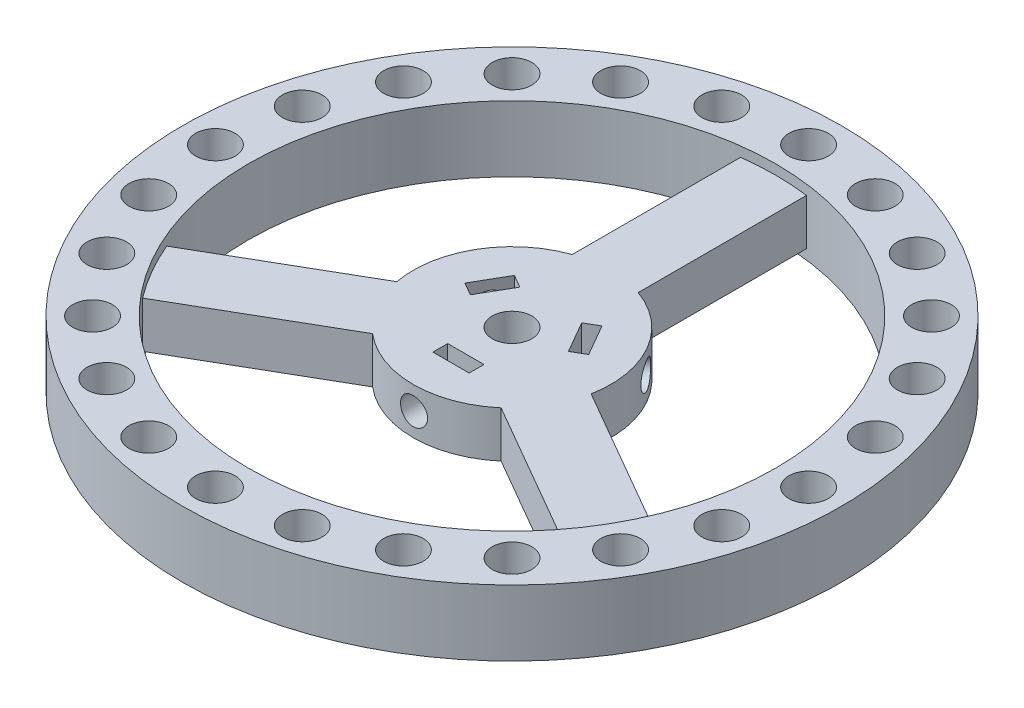
from build123d import *

# Parameters (mm, degrees)
SKETCH2_R                = 3
BOSS_EXTRUDE4_DEPTH      = 10
BOSS_EXTRUDE8_DEPTH      = 3.5
BOSS_EXTRUDE8_DEPTH_BACK = 3.5
BOSS_EXTRUDE8_START      = 5
SKETCH7_W                = 5.5
SKETCH7_H                = 2.25
CUT_EXTRUDE2_DEPTH       = 72.219730412
CUT_EXTRUDE3_DEPTH       = 16
CUT_EXTRUDE4_DEPTH       = 17
CUT_EXTRUDE5_DEPTH       = 22


with BuildPart() as part:
    # Sketch2 → Boss-Extrude4 (new body)
    # profile 1 of 4: a face of its own
    with BuildSketch(Plane(origin=(0, 0, 0), x_dir=(1, 0, 0), z_dir=(0, 1, 0))):
        with BuildLine():
            Line((0, -42), (0, -40))
            ThreePointArc((0, -40), (-17.79142386, -35.825483068), (-31.869317712, -24.173261852))
            ThreePointArc((-31.869317712, -24.173261852), (-33.320566566, -22.13006651), (-34.641016151, -20))
            Line((-34.641016151, -20), (-36.373066959, -21))
            ThreePointArc((-36.373066959, -21), (-36.073365691, -21.723542865), (-35.97114317, -22.5))
            ThreePointArc((-35.97114317, -22.5), (-38.194686035, -25.397777479), (-41.569219382, -24))
            Line((-41.569219382, -24), (-43.301270189, -25))
            ThreePointArc((-43.301270189, -25), (-25, -43.301270189), (0, -50))
            Line((0, -50), (0, -48))
            ThreePointArc((0, -48), (-3, -45), (0, -42))
        make_face()
        with Locations(Location((-31.819805153, -31.819805153, 0), (0, 0, 270))):
            Circle(SKETCH2_R, mode=Mode.SUBTRACT)
        with Locations(Location((-22.5, -38.97114317, 0), (0, 0, 270))):
            Circle(SKETCH2_R, mode=Mode.SUBTRACT)
        with Locations(Location((-11.64685703, -43.466662183, 0), (0, 0, 270))):
            Circle(SKETCH2_R, mode=Mode.SUBTRACT)
    # profile 2 of 4: a face of its own
    with BuildSketch(Plane(origin=(0, 0, 0), x_dir=(1, 0, 0), z_dir=(0, 1, 0))):
        with BuildLine():
            Line((-36.373066959, -21), (-34.641016151, -20))
            ThreePointArc((-34.641016151, -20), (-35.825483068, -17.79142386), (-36.869317712, -15.513007814))
            ThreePointArc((-36.869317712, -15.513007814), (-34.641016151, 20), (-5, 39.686269666))
            ThreePointArc((-5, 39.686269666), (-2.504916502, 39.921490369), (0, 40))
            Line((0, 40), (0, 42))
            ThreePointArc((0, 42), (-3, 45), (0, 48))
            Line((0, 48), (0, 50))
            ThreePointArc((0, 50), (-43.301270189, 25), (-43.301270189, -25))
            Line((-43.301270189, -25), (-41.569219382, -24))
            ThreePointArc((-41.569219382, -24), (-40.47114317, -19.901923789), (-36.373066959, -21))
        make_face()
        with Locations(Location((-43.466662183, -11.64685703, 0), (0, 0, 270))):
            Circle(SKETCH2_R, mode=Mode.SUBTRACT)
        with Locations(Location((-45, 0, 0), (0, 0, 270))):
            Circle(SKETCH2_R, mode=Mode.SUBTRACT)
        with Locations(Location((-43.466662183, 11.64685703, 0), (0, 0, 270))):
            Circle(SKETCH2_R, mode=Mode.SUBTRACT)
        with Locations(Location((-38.97114317, 22.5, 0), (0, 0, 270))):
            Circle(SKETCH2_R, mode=Mode.SUBTRACT)
        with Locations(Location((-31.819805153, 31.819805153, 0), (0, 0, 270))):
            Circle(SKETCH2_R, mode=Mode.SUBTRACT)
        with Locations(Location((-22.5, 38.97114317, 0), (0, 0, 270))):
            Circle(SKETCH2_R, mode=Mode.SUBTRACT)
        with BuildLine():
            ThreePointArc((-8.64685703, 43.466662183), (-8.650208153, 43.324903542), (-8.660254038, 43.183461601))
            ThreePointArc((-8.660254038, 43.183461601), (-14.64685703, 43.466662183), (-8.660254038, 43.749862765))
            ThreePointArc((-8.660254038, 43.749862765), (-8.650208153, 43.608420824), (-8.64685703, 43.466662183))
        make_face(mode=Mode.SUBTRACT)
    # profile 3 of 4: a face of its own
    with BuildSketch(Plane(origin=(0, 0, 0), x_dir=(1, 0, 0), z_dir=(0, 1, 0))):
        with BuildLine():
            ThreePointArc((36.869317712, -15.513007814), (35.825483068, -17.79142386), (34.641016151, -20))
            Line((34.641016151, -20), (36.373066959, -21))
            ThreePointArc((36.373066959, -21), (39.747600306, -19.602222521), (41.97114317, -22.5))
            ThreePointArc((41.97114317, -22.5), (41.868920649, -23.276457135), (41.569219382, -24))
            Line((41.569219382, -24), (43.301270189, -25))
            ThreePointArc((43.301270189, -25), (48.296291314, -12.940952255), (50, 0))
            ThreePointArc((50, 0), (35.355339059, 35.355339059), (0, 50))
            Line((0, 50), (0, 48))
            ThreePointArc((0, 48), (2.121320344, 47.121320344), (3, 45))
            ThreePointArc((3, 45), (2.121320344, 42.878679656), (0, 42))
            Line((0, 42), (0, 40))
            ThreePointArc((0, 40), (2.504916502, 39.921490369), (5, 39.686269666))
            ThreePointArc((5, 39.686269666), (30, 26.457513111), (40, 0))
            ThreePointArc((40, 0), (39.209518669, -7.912878475), (36.869317712, -15.513007814))
        make_face()
        with Locations(Location((43.466662183, -11.64685703, 0), (0, 0, 270))):
            Circle(SKETCH2_R, mode=Mode.SUBTRACT)
        with Locations(Location((45, 0, 0), (0, 0, 270))):
            Circle(SKETCH2_R, mode=Mode.SUBTRACT)
        with Locations(Location((43.466662183, 11.64685703, 0), (0, 0, 270))):
            Circle(SKETCH2_R, mode=Mode.SUBTRACT)
        with Locations(Location((38.97114317, 22.5, 0), (0, 0, 270))):
            Circle(SKETCH2_R, mode=Mode.SUBTRACT)
        with BuildLine():
            ThreePointArc((14.64685703, 43.466662183), (11.788615671, 40.470013307), (8.660254038, 43.183461601))
            ThreePointArc((8.660254038, 43.183461601), (8.64685703, 43.466662183), (8.660254038, 43.749862765))
            ThreePointArc((8.660254038, 43.749862765), (11.788615671, 46.463311059), (14.64685703, 43.466662183))
        make_face(mode=Mode.SUBTRACT)
        with Locations(Location((22.5, 38.97114317, 0), (0, 0, 270))):
            Circle(SKETCH2_R, mode=Mode.SUBTRACT)
        with Locations(Location((31.819805153, 31.819805153, 0), (0, 0, 270))):
            Circle(SKETCH2_R, mode=Mode.SUBTRACT)
    # profile 4 of 4: a face of its own
    with BuildSketch(Plane(origin=(0, 0, 0), x_dir=(1, 0, 0), z_dir=(0, 1, 0))):
        with BuildLine():
            ThreePointArc((31.869317712, -24.173261852), (17.79142386, -35.825483068), (0, -40))
            Line((0, -40), (0, -42))
            ThreePointArc((0, -42), (2.121320344, -42.878679656), (3, -45))
            ThreePointArc((3, -45), (2.121320344, -47.121320344), (0, -48))
            Line((0, -48), (0, -50))
            ThreePointArc((0, -50), (25, -43.301270189), (43.301270189, -25))
            Line((43.301270189, -25), (41.569219382, -24))
            ThreePointArc((41.569219382, -24), (37.47114317, -25.098076211), (36.373066959, -21))
            Line((36.373066959, -21), (34.641016151, -20))
            ThreePointArc((34.641016151, -20), (33.320566566, -22.13006651), (31.869317712, -24.173261852))
        make_face()
        with Locations(Location((11.64685703, -43.466662183, 0), (0, 0, 270))):
            Circle(SKETCH2_R, mode=Mode.SUBTRACT)
        with Locations(Location((22.5, -38.97114317, 0), (0, 0, 270))):
            Circle(SKETCH2_R, mode=Mode.SUBTRACT)
        with Locations(Location((31.819805153, -31.819805153, 0), (0, 0, 270))):
            Circle(SKETCH2_R, mode=Mode.SUBTRACT)
    extrude(amount=BOSS_EXTRUDE4_DEPTH)

    # Sketch6 → Boss-Extrude8 (add, two sides: drawn at the far end of the back side and taken through both)
    with BuildSketch(Plane(origin=(0, 0, 0), x_dir=(1, 0, 0), z_dir=(0, 1, 0)).offset(BOSS_EXTRUDE8_START - BOSS_EXTRUDE8_DEPTH_BACK)):
        with BuildLine():
            Line((-34.641016151, -20), (-12.990381057, -7.5))
            ThreePointArc((-12.990381057, -7.5), (-14.071565699, -5.195290056), (-14.747448714, -2.740940793))
            Line((-14.747448714, -2.740940793), (-36.869317712, -15.513007814))
            ThreePointArc((-36.869317712, -15.513007814), (-35.825483068, -17.79142386), (-34.641016151, -20))
        make_face()
        with BuildLine():
            ThreePointArc((-9.747448714, -11.401194831), (-11.535036018, -9.588688339), (-12.990381057, -7.5))
            Line((-12.990381057, -7.5), (-34.641016151, -20))
            ThreePointArc((-34.641016151, -20), (-33.320566566, -22.13006651), (-31.869317712, -24.173261852))
            Line((-31.869317712, -24.173261852), (-9.747448714, -11.401194831))
        make_face()
        with BuildLine():
            Line((-12.990381057, -7.5), (0, 0))
            Line((0, 0), (0, 15))
            ThreePointArc((0, 15), (-2.536529681, 14.783978395), (-5, 14.142135624))
            ThreePointArc((-5, 14.142135624), (-12.990381057, 7.5), (-14.747448714, -2.740940793))
            ThreePointArc((-14.747448714, -2.740940793), (-14.071565699, -5.195290056), (-12.990381057, -7.5))
        make_face()
        with BuildLine():
            Line((0, 15), (0, 0))
            Line((0, 0), (12.990381057, -7.5))
            ThreePointArc((12.990381057, -7.5), (14.071565699, -5.195290056), (14.747448714, -2.740940793))
            ThreePointArc((14.747448714, -2.740940793), (14.936728737, -1.376275643), (15, 0))
            ThreePointArc((15, 0), (12.247448714, 8.660254038), (5, 14.142135624))
            ThreePointArc((5, 14.142135624), (2.536529681, 14.783978395), (0, 15))
        make_face()
        with BuildLine():
            Line((12.990381057, -7.5), (0, 0))
            Line((0, 0), (-12.990381057, -7.5))
            ThreePointArc((-12.990381057, -7.5), (-11.535036018, -9.588688339), (-9.747448714, -11.401194831))
            ThreePointArc((-9.747448714, -11.401194831), (0, -15), (9.747448714, -11.401194831))
            ThreePointArc((9.747448714, -11.401194831), (11.535036018, -9.588688339), (12.990381057, -7.5))
        make_face()
        with BuildLine():
            Line((0, 40), (0, 15))
            ThreePointArc((0, 15), (2.536529681, 14.783978395), (5, 14.142135624))
            Line((5, 14.142135624), (5, 39.686269666))
            ThreePointArc((5, 39.686269666), (2.504916502, 39.921490369), (0, 40))
        make_face()
        with BuildLine():
            ThreePointArc((-5, 14.142135624), (-2.536529681, 14.783978395), (0, 15))
            Line((0, 15), (0, 40))
            ThreePointArc((0, 40), (-2.504916502, 39.921490369), (-5, 39.686269666))
            Line((-5, 39.686269666), (-5, 14.142135624))
        make_face()
        with BuildLine():
            ThreePointArc((14.747448714, -2.740940793), (14.071565699, -5.195290056), (12.990381057, -7.5))
            Line((12.990381057, -7.5), (34.641016151, -20))
            ThreePointArc((34.641016151, -20), (35.825483068, -17.79142386), (36.869317712, -15.513007814))
            Line((36.869317712, -15.513007814), (14.747448714, -2.740940793))
        make_face()
        with BuildLine():
            Line((34.641016151, -20), (12.990381057, -7.5))
            ThreePointArc((12.990381057, -7.5), (11.535036018, -9.588688339), (9.747448714, -11.401194831))
            Line((9.747448714, -11.401194831), (31.869317712, -24.173261852))
            ThreePointArc((31.869317712, -24.173261852), (33.320566566, -22.13006651), (34.641016151, -20))
        make_face()
    extrude(amount=BOSS_EXTRUDE8_DEPTH + BOSS_EXTRUDE8_DEPTH_BACK)

    # Sketch7 → Cut-Extrude2 (cut, through all)
    with BuildSketch(Plane(origin=(0, 8.5, 0), x_dir=(1, 0, 0), z_dir=(0, 1, 0))):
        Polygon((-4.691507954, 5.88406986), (-6.640065112, 7.00906986), (-9.390065112, 2.24593014), (-7.441507954, 1.12093014), align=None)
        with BuildLine():
            Line((-2.602406338, 1.5025), (0, 0))
            Line((0, 0), (2.602406338, 1.5025))
            ThreePointArc((2.602406338, 1.5025), (0, 3.005), (-2.602406338, 1.5025))
        make_face()
        with BuildLine():
            ThreePointArc((-2.602406338, 1.5025), (-2.602406338, -1.5025), (0, -3.005))
            Line((0, -3.005), (0, 0))
            Line((0, 0), (-2.602406338, 1.5025))
        make_face()
        with BuildLine():
            Line((0, 0), (0, -3.005))
            ThreePointArc((0, -3.005), (2.124855877, -2.124855877), (3.005, 0))
            ThreePointArc((3.005, 0), (2.902607108, 0.777751231), (2.602406338, 1.5025))
            Line((2.602406338, 1.5025), (0, 0))
        make_face()
        Polygon((7.441507954, 1.12093014), (9.390065112, 2.24593014), (6.640065112, 7.00906986), (4.691507954, 5.88406986), align=None)
        with Locations((0, -8.13)):
            Rectangle(SKETCH7_W, SKETCH7_H)
    extrude(amount=-CUT_EXTRUDE2_DEPTH, mode=Mode.SUBTRACT)

    # Sketch13 → Cut-Extrude3 (cut)
    with BuildSketch(Plane(origin=(-6.066507954, 0, -3.5025), x_dir=(-0.5000000000000038, 0, 0.8660254037844365), z_dir=(-0.8660254037844366, 0, -0.5000000000000038))):
        with BuildLine():
            ThreePointArc((0, 7.05), (-2.05, 5), (0, 2.95))
            Line((0, 2.95), (0, 7.05))
        make_face()
        with BuildLine():
            Line((0, 7.05), (0, 2.95))
            ThreePointArc((0, 2.95), (1.449568901, 3.550431099), (2.05, 5))
            ThreePointArc((2.05, 5), (1.449568901, 6.449568901), (0, 7.05))
        make_face()
    extrude(amount=CUT_EXTRUDE3_DEPTH, mode=Mode.SUBTRACT)

    # Sketch12 → Cut-Extrude4 (cut)
    with BuildSketch(Plane.XY.offset(7.005)):
        with BuildLine():
            ThreePointArc((0, 7.05), (-2.05, 5), (0, 2.95))
            Line((0, 2.95), (0, 7.05))
        make_face()
        with BuildLine():
            Line((0, 7.05), (0, 2.95))
            ThreePointArc((0, 2.95), (1.449568901, 3.550431099), (2.05, 5))
            ThreePointArc((2.05, 5), (1.449568901, 6.449568901), (0, 7.05))
        make_face()
    extrude(amount=CUT_EXTRUDE4_DEPTH, mode=Mode.SUBTRACT)

    # Sketch11 → Cut-Extrude5 (cut)
    with BuildSketch(Plane(origin=(6.066507954, 0, -3.5025), x_dir=(-0.4999999999999923, 0, -0.8660254037844431), z_dir=(0.866025403784443, 0, -0.49999999999999223))):
        with BuildLine():
            ThreePointArc((0, 7.05), (-2.05, 5), (0, 2.95))
            Line((0, 2.95), (0, 7.05))
        make_face()
        with BuildLine():
            Line((0, 7.05), (0, 2.95))
            ThreePointArc((0, 2.95), (1.449568901, 3.550431099), (2.05, 5))
            ThreePointArc((2.05, 5), (1.449568901, 6.449568901), (0, 7.05))
        make_face()
    extrude(amount=CUT_EXTRUDE5_DEPTH, mode=Mode.SUBTRACT)


solid = part.part
